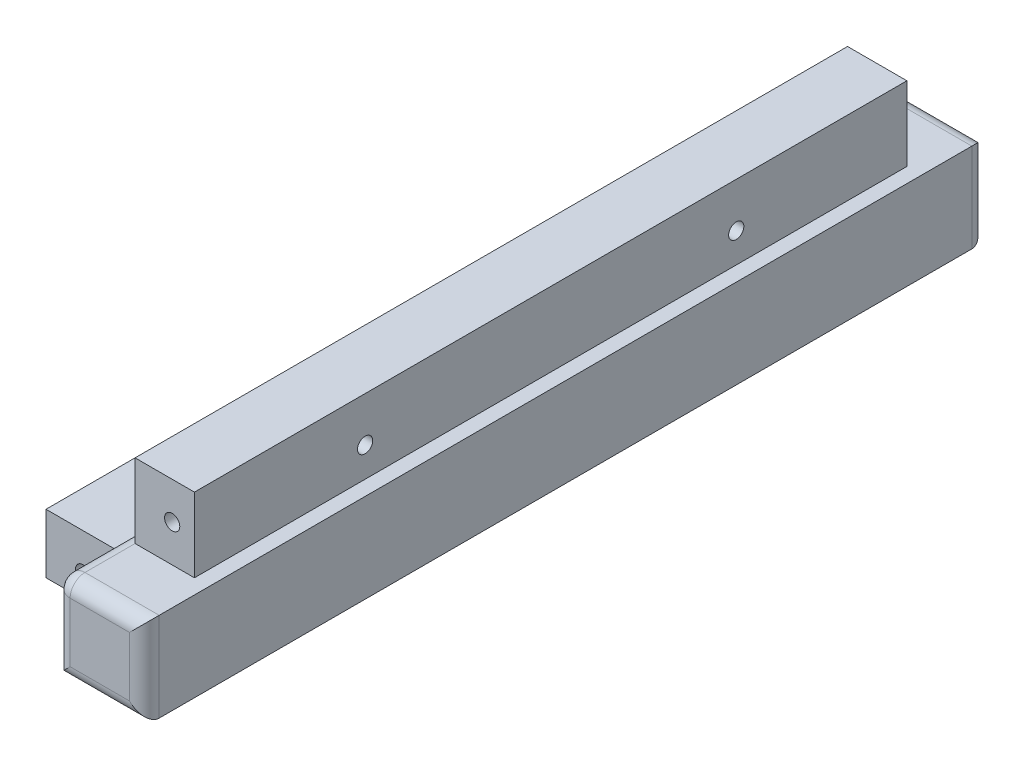
from build123d import *

# Parameters (mm, degrees)
SCHIZZO1_W                   = 12
SCHIZZO1_H                   = 12
ESTRUSIONE_ESTRUSIONE1_DEPTH = 56.75
RACCORDO1_R                  = 2
ESTRUSIONE_ESTRUSIONE3_START = -8.75
SCHIZZO3_W                   = 8
SCHIZZO3_H                   = 10
SCHIZZO3_W_2                 = 10
SCHIZZO3_H_2                 = 8
ESTRUSIONE_ESTRUSIONE3_DEPTH = 96
FORO_FILETTATO_M2_5_3_D      = 2.05
FORO_FILETTATO_M2_5_3_DEPTH  = 6.884117865
FORO_FILETTATO_M2_5_3_TIP    = 0.615882135
FORO_FILETTATO_M2_5_4_D      = 2.05
FORO_FILETTATO_M2_5_4_DEPTH  = 6.884117865
FORO_FILETTATO_M2_5_4_TIP    = 0.615882135


with BuildPart() as part:
    # Schizzo1 → Estrusione-Estrusione1 (new, symmetric)
    with BuildSketch(Plane.XY):
        Rectangle(SCHIZZO1_W, SCHIZZO1_H)
    extrude(amount=ESTRUSIONE_ESTRUSIONE1_DEPTH, both=True)

    # Raccordo1
    raccordo1_edges = [part.edges().sort_by_distance(p)[0] for p in [
        (-6, 0, 56.75),
        (0, -6, 56.75),
        (6, 0, 56.75),
        (0, -6, -56.75),
        (-6, 0, -56.75),
        (0, 6, -56.75),
        (6, 0, -56.75),
        (-6, 6, 0),
        (0, 6, 56.75),
    ]]
    fillet(raccordo1_edges, radius=RACCORDO1_R)

    # Schizzo3 → Estrusione-Estrusione3 (add)
    with BuildSketch(Plane.XY.offset(56.75).offset(ESTRUSIONE_ESTRUSIONE3_START)):
        with Locations((0, 11)):
            Rectangle(SCHIZZO3_W, SCHIZZO3_H)
        with Locations((-11, 0)):
            Rectangle(SCHIZZO3_W_2, SCHIZZO3_H_2)
    extrude(amount=-ESTRUSIONE_ESTRUSIONE3_DEPTH)

    # Schizzo5 → Foro filettato M2.5-1 (revolve, cut)
    with BuildSketch(Plane(origin=(1, 11, 48), x_dir=(0, -1, 0), z_dir=(1, 0, 0))):
        Polygon((0, 0), (0, 7.5), (1.025, 6.884117865), (1.025, 0), align=None)
    foro_filettato_m2_5_1 = revolve(axis=Axis((1, 11, 54.35), (0, 0, -1)), mode=Mode.SUBTRACT)

    # Schizzo8 → Foro filettato M2.5-2 (revolve, cut)
    with BuildSketch(Plane(origin=(-11, -1, 48), x_dir=(0, -1, 0), z_dir=(1, 0, 0))):
        Polygon((0, 0), (0, 7.5), (1.025, 6.884117865), (1.025, 0), align=None)
    foro_filettato_m2_5_2 = revolve(axis=Axis((-11, -1, 54.35), (0, 0, -1)), mode=Mode.SUBTRACT)

    # Specchia2: Foro filettato M2.5-1, Foro filettato M2.5-2 across plane
    add(foro_filettato_m2_5_1.mirror(Plane.XY), mode=Mode.SUBTRACT)
    add(foro_filettato_m2_5_2.mirror(Plane.XY), mode=Mode.SUBTRACT)

    # Foro filettato M2.5-3
    with Locations(Plane(origin=(4, 0, 0), x_dir=(0, 0, -1), z_dir=(1, 0, 0))):
        with Locations((-25, 10), (25, 10)):
            Hole(FORO_FILETTATO_M2_5_3_D / 2, depth=FORO_FILETTATO_M2_5_3_DEPTH)
            with Locations((0, 0, -(FORO_FILETTATO_M2_5_3_DEPTH + FORO_FILETTATO_M2_5_3_TIP / 2))):  # 118° drill point
                Cone(0, FORO_FILETTATO_M2_5_3_D / 2, FORO_FILETTATO_M2_5_3_TIP, mode=Mode.SUBTRACT)

    # Foro filettato M2.5-4
    with Locations(Plane(origin=(0, -4, 0), x_dir=(-1, 0, 0), z_dir=(0, -1, 0))):
        with Locations((10, 25), (10, -25)):
            Hole(FORO_FILETTATO_M2_5_4_D / 2, depth=FORO_FILETTATO_M2_5_4_DEPTH)
            with Locations((0, 0, -(FORO_FILETTATO_M2_5_4_DEPTH + FORO_FILETTATO_M2_5_4_TIP / 2))):  # 118° drill point
                Cone(0, FORO_FILETTATO_M2_5_4_D / 2, FORO_FILETTATO_M2_5_4_TIP, mode=Mode.SUBTRACT)


solid = part.part
